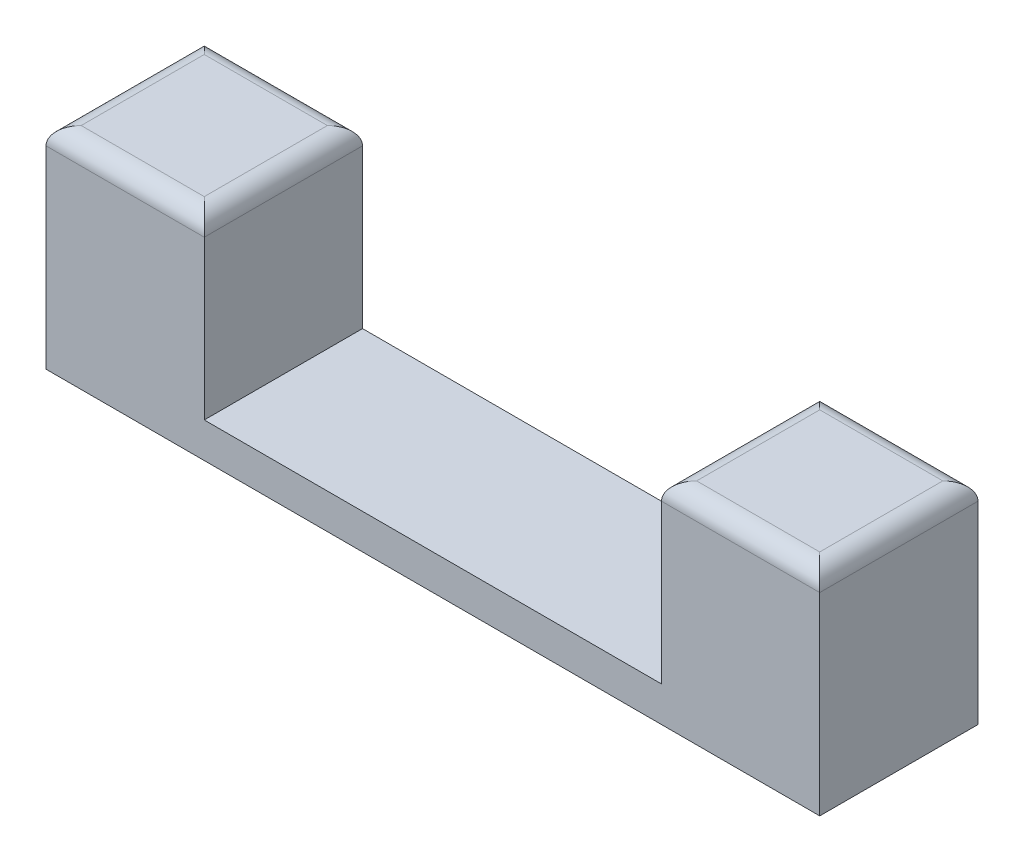
from build123d import *

# Parameters (mm, degrees)
SKETCH1_W           = 22
SKETCH1_H           = 4.5
BOSS_EXTRUDE1_DEPTH = 1
SKETCH2_W           = 4.5
SKETCH2_H           = 4.5
BOSS_EXTRUDE2_DEPTH = 5
FILLET1_R           = 0.5


with BuildPart() as part:
    # Sketch1 → Boss-Extrude1 (new body)
    with BuildSketch(Plane(origin=(0, 0, 0), x_dir=(1, 0, 0), z_dir=(0, 1, 0))):
        Rectangle(SKETCH1_W, SKETCH1_H)
    extrude(amount=BOSS_EXTRUDE1_DEPTH)

    # Sketch2 → Boss-Extrude2 (add)
    with BuildSketch(Plane(origin=(0, 1, 0), x_dir=(1, 0, 0), z_dir=(0, 1, 0))):
        with Locations((-8.75, 0)):
            Rectangle(SKETCH2_W, SKETCH2_H)
        with Locations((8.75, 0)):
            Rectangle(SKETCH2_W, SKETCH2_H)
    extrude(amount=BOSS_EXTRUDE2_DEPTH)

    # Fillet1
    fillet1_edges = [part.edges().sort_by_distance(p)[0] for p in [
        (8.75, 6, -2.25),
        (11, 6, 0),
        (8.75, 6, 2.25),
        (6.5, 6, 0),
        (-6.5, 6, 0),
        (-8.75, 6, 2.25),
        (-11, 6, 0),
        (-8.75, 6, -2.25),
    ]]
    fillet(fillet1_edges, radius=FILLET1_R)


solid = part.part
